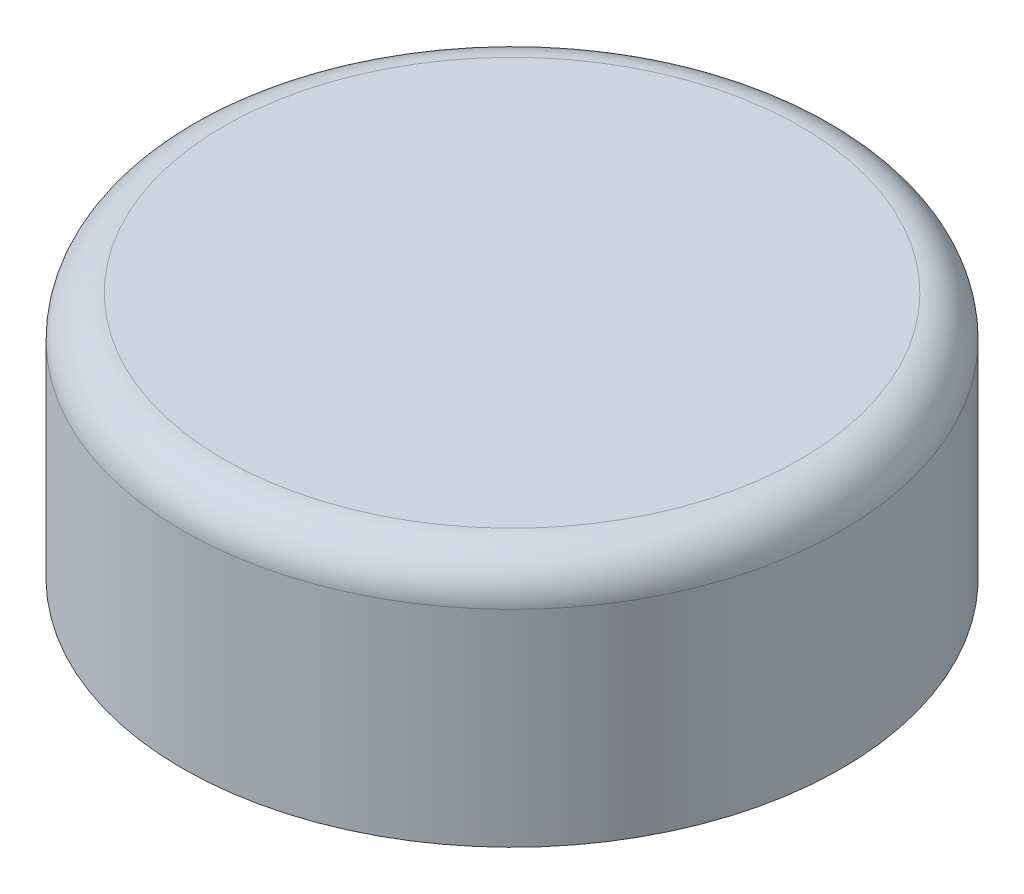
from build123d import *

# Parameters (mm, degrees)
SKETCH1_R           = 4
BOSS_EXTRUDE1_DEPTH = 3
FILLET1_R           = 0.5


with BuildPart() as part:
    # Sketch1 → Boss-Extrude1 (new body)
    with BuildSketch(Plane(origin=(0, 0, 0), x_dir=(1, 0, 0), z_dir=(0, 1, 0))):
        with Locations(Location((0, 0, 0), (0, 0, 270))):
            Circle(SKETCH1_R)
    extrude(amount=BOSS_EXTRUDE1_DEPTH)

    # Fillet1
    fillet1_edges = [part.edges().sort_by_distance(p)[0] for p in [
        (0, 3, -4),
    ]]
    fillet(fillet1_edges, radius=FILLET1_R)


solid = part.part
